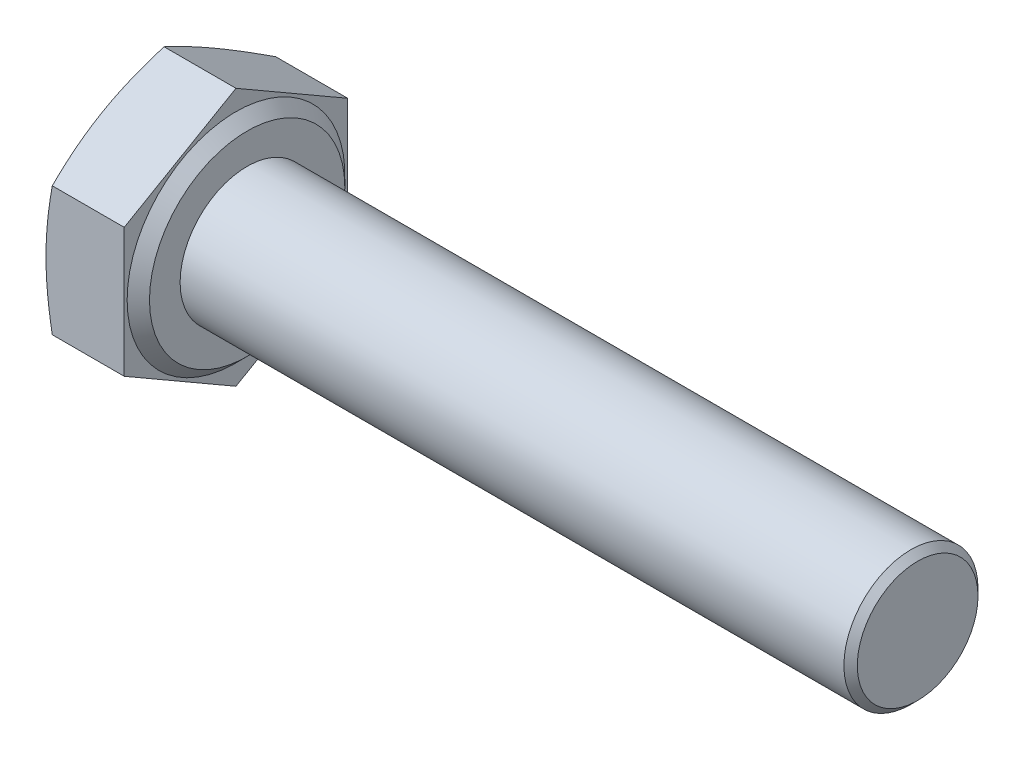
from build123d import *

# Parameters (mm, degrees)
BASEHEAD_DEPTH = 4
SKETCH5_R      = 3
BASEBODY_DEPTH = 30
CHAMFER1_SIZE  = 0.3
SCALE_1_SCALE  = 0.25


with BuildPart() as part:
    # Sketch2 → BaseHead (new body)
    with BuildSketch(Plane(origin=(0, 0, 0), x_dir=(0, 0, -1), z_dir=(1, 0, 0))):
        Polygon((0, -5.773502692), (5, -2.886751346), (5, 2.886751346), (0, 5.773502692), (-5, 2.886751346), (-5, -2.886751346), align=None)
    extrude(amount=BASEHEAD_DEPTH)

    # Sketch3 → BearingFace (revolve, cut)
    with BuildSketch(Plane.XY, mode=Mode.PRIVATE) as bearingface_sk:
        Polygon((4, 5.773502692), (4, 4.37), (3.5, 4.87), (3.5, 5.773502692), align=None)
    revolve(bearingface_sk.sketch.rotate(Axis((-0.957090588, 0, 0), (1, 0, 0)), 90), axis=Axis((-0.957090588, 0, 0), (1, 0, 0)), mode=Mode.SUBTRACT)

    # Sketch4 → HeadChamfer (revolve, cut)
    with BuildSketch(Plane.XY):
        Polygon((0, 5.773502692), (0.281531956, 5.773502692), (0, 5), align=None)
    revolve(axis=Axis((-0.493528746, 0, 0), (1, 0, 0)), mode=Mode.SUBTRACT)

    # Sketch5 → BaseBody (add)
    with BuildSketch(Plane(origin=(4, 0, 0), x_dir=(0, 0, -1), z_dir=(1, 0, 0))):
        with Locations(Location((0, 0, 0), (0, 0, 180))):
            Circle(SKETCH5_R)
    extrude(amount=BASEBODY_DEPTH)

    # Chamfer1
    chamfer1_edges = [part.edges().sort_by_distance(p)[0] for p in [
        (34, 0, -3),
    ]]
    chamfer(chamfer1_edges, length=CHAMFER1_SIZE)


with BuildPart() as part_1:
    # 缩放比例1: scaled about (0, 0, 0)
    add(part.part.scale(SCALE_1_SCALE))


solid = part_1.part
